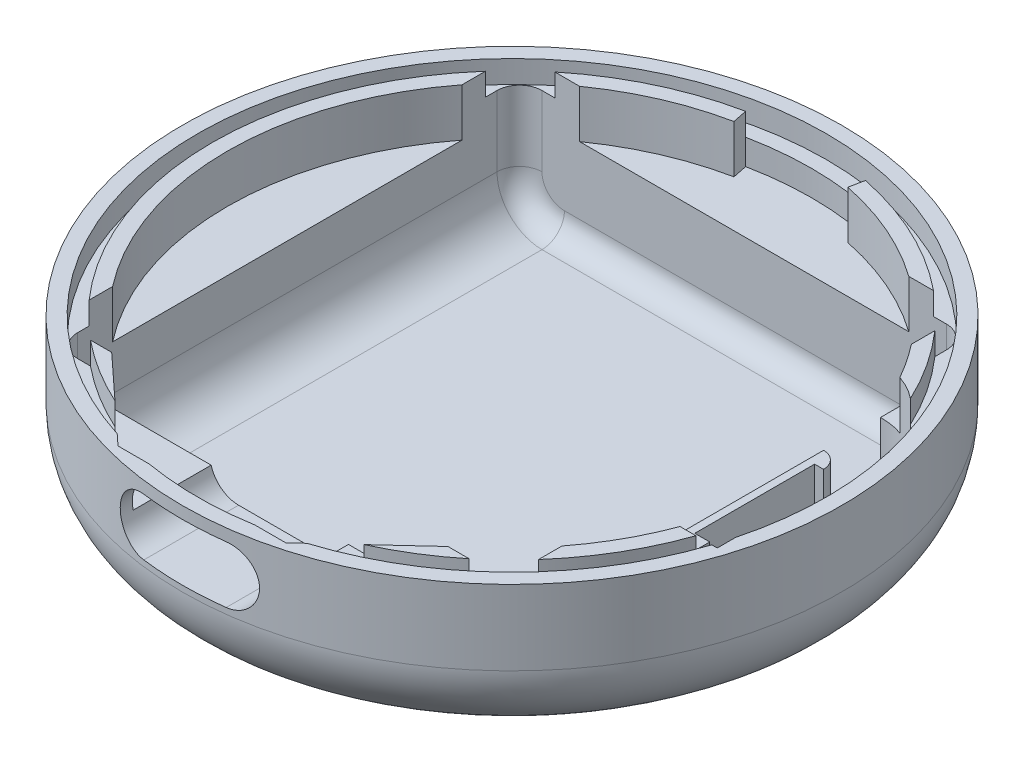
from build123d import *

# Parameters (mm, degrees)
SKETCH1_R               = 22
BOSS_EXTRUDE1_DEPTH     = 10
CUT_EXTRUDE1_DEPTH      = 3.2
CUT_EXTRUDE2_DEPTH      = 32.847134879
CUT_EXTRUDE2_DEPTH_BACK = 6
SKETCH3_W               = 30
SKETCH3_H               = 31
CUT_EXTRUDE3_DEPTH      = 6
CUT_EXTRUDE3_DEPTH_BACK = 50.064141692
FILLET1_R               = 3
FILLET2_R               = 1.5
FILLET3_R               = 5
CUT_EXTRUDE4_DEPTH      = 32.847135017
CUT_EXTRUDE4_DEPTH_BACK = 4
CUT_EXTRUDE6_DEPTH      = 2.3
SKETCH10_R              = 21
CUT_EXTRUDE5_DEPTH      = 1.5


with BuildPart() as part:
    # Sketch1 → Boss-Extrude1 (new body)
    with BuildSketch(Plane(origin=(0, 0, 0), x_dir=(1, 0, 0), z_dir=(0, 1, 0))):
        with Locations(Location((0, 0, 0), (0, 0, 270))):
            Circle(SKETCH1_R)
    extrude(amount=BOSS_EXTRUDE1_DEPTH)

    # Sketch2 → Cut-Extrude1 (cut)
    with BuildSketch(Plane(origin=(0, 10, 0), x_dir=(1, 0, 0), z_dir=(0, 1, 0))):
        with BuildLine():
            Line((4, 19.595917942), (3.8, 18.616122045))
            ThreePointArc((3.8, 18.616122045), (0, -19), (-3.8, 18.616122045))
            Line((-3.8, 18.616122045), (-4, 19.595917942))
            ThreePointArc((-4, 19.595917942), (0, 20), (4, 19.595917942))
        make_face()
        with BuildLine():
            ThreePointArc((12.899684367, -13.949843843), (0, -19), (-12.899684367, -13.949843843))
            Line((-12.899684367, -13.949843843), (-5.6, -20.7))
            Line((-5.6, -20.7), (5.6, -20.7))
            Line((5.6, -20.7), (12.899684367, -13.949843843))
        make_face()
    extrude(amount=-CUT_EXTRUDE1_DEPTH, mode=Mode.SUBTRACT)

    # Sketch3 → Cut-Extrude2 (cut, two sides: drawn at the far end of the back side and taken through both)
    with BuildSketch(Plane(origin=(0, 6.8, 0), x_dir=(1, 0, 0), z_dir=(0, 1, 0)).offset(-CUT_EXTRUDE2_DEPTH_BACK)):
        Rectangle(SKETCH3_W, SKETCH3_H)
    extrude(amount=CUT_EXTRUDE2_DEPTH + CUT_EXTRUDE2_DEPTH_BACK, mode=Mode.SUBTRACT)

    # Sketch5 → Cut-Extrude3 (cut, two sides: drawn at the far end of the back side and taken through both)
    with BuildSketch(Plane(origin=(0, 0, 20.7), x_dir=(-1, 0, 0), z_dir=(0, 0, -1)).offset(-CUT_EXTRUDE3_DEPTH_BACK)):
        with BuildLine():
            Line((-2.75, 9.2), (2.75, 9.2))
            ThreePointArc((2.75, 9.2), (4.65, 7.3), (2.75, 5.4))
            Line((2.75, 5.4), (-2.75, 5.4))
            ThreePointArc((-2.75, 5.4), (-4.65, 7.3), (-2.75, 9.2))
        make_face()
    extrude(amount=CUT_EXTRUDE3_DEPTH + CUT_EXTRUDE3_DEPTH_BACK, mode=Mode.SUBTRACT)

    # Fillet1
    fillet1_edges = [part.edges().sort_by_distance(p)[0] for p in [
        (-15, 0.8, 0),
        (15, 0.8, 0),
    ]]
    fillet(fillet1_edges, radius=FILLET1_R)

    # Fillet2
    fillet2_edges = [part.edges().sort_by_distance(p)[0] for p in [
        (0, 0.8, 15.5),
        (0, 0.8, -15.5),
        (14.121320344, 1.678679656, 15.5),
        (-14.121320344, 1.678679656, 15.5),
        (14.121320344, 1.678679656, -15.5),
        (-14.121320344, 1.678679656, -15.5),
        (-15, 6.9, -15.5),
        (-15, 6.9, 15.5),
        (15, 6.9, 15.5),
        (15, 6.9, -15.5),
    ]]
    fillet(fillet2_edges, radius=FILLET2_R)

    # Fillet3
    fillet3_edges = [part.edges().sort_by_distance(p)[0] for p in [
        (0, 0, -22),
    ]]
    fillet(fillet3_edges, radius=FILLET3_R)

    # Sketch6 → Cut-Extrude4 (cut, two sides: drawn at the far end of the back side and taken through both)
    with BuildSketch(Plane(origin=(0, 6.8, 0), x_dir=(1, 0, 0), z_dir=(0, 1, 0)).offset(-CUT_EXTRUDE4_DEPTH_BACK)):
        Polygon((16.5, -3.3), (16.5, -4.3), (19.5, -4.3), (19.5, -3.3), (20.5, -3.3), (20.5, 4.7), (19.9, 4.7), (16.1, 4.7), (15.5, 4.7), (15.5, -3.3), align=None)
        with BuildLine():
            ThreePointArc((15, 5.8), (15.777817459, 5.477817459), (16.1, 4.7))
            Line((16.1, 4.7), (19.9, 4.7))
            ThreePointArc((19.9, 4.7), (18.464823228, 8.164823228), (15, 9.6))
            Line((15, 9.6), (15, 5.8))
        make_face()
    extrude(amount=CUT_EXTRUDE4_DEPTH + CUT_EXTRUDE4_DEPTH_BACK, mode=Mode.SUBTRACT)

    # Sketch11 → Cut-Extrude6 (cut)
    with BuildSketch(Plane.XY.offset(4.3)):
        with BuildLine():
            Line((15.7, 5.1), (15.7, 10))
            Line((15.7, 10), (20.3, 10))
            Line((20.3, 10), (20.3, 5.1))
            ThreePointArc((20.3, 5.1), (18, 2.8), (15.7, 5.1))
        make_face()
    extrude(amount=CUT_EXTRUDE6_DEPTH, mode=Mode.SUBTRACT)

    # Sketch10 → Cut-Extrude5 (cut)
    with BuildSketch(Plane(origin=(0, 10, 0), x_dir=(1, 0, 0), z_dir=(0, 1, 0))):
        Circle(SKETCH10_R)
        with BuildLine():
            Line((19.5, -4.3), (19.532280973, -4.3))
            ThreePointArc((19.532280973, -4.3), (-19.635443226, 3.801232604), (19.725871337, -3.3))
            Line((19.725871337, -3.3), (19.5, -3.3))
            Line((19.5, -3.3), (19.5, -4.3))
        make_face(mode=Mode.SUBTRACT)
    extrude(amount=-CUT_EXTRUDE5_DEPTH, mode=Mode.SUBTRACT)


solid = part.part
